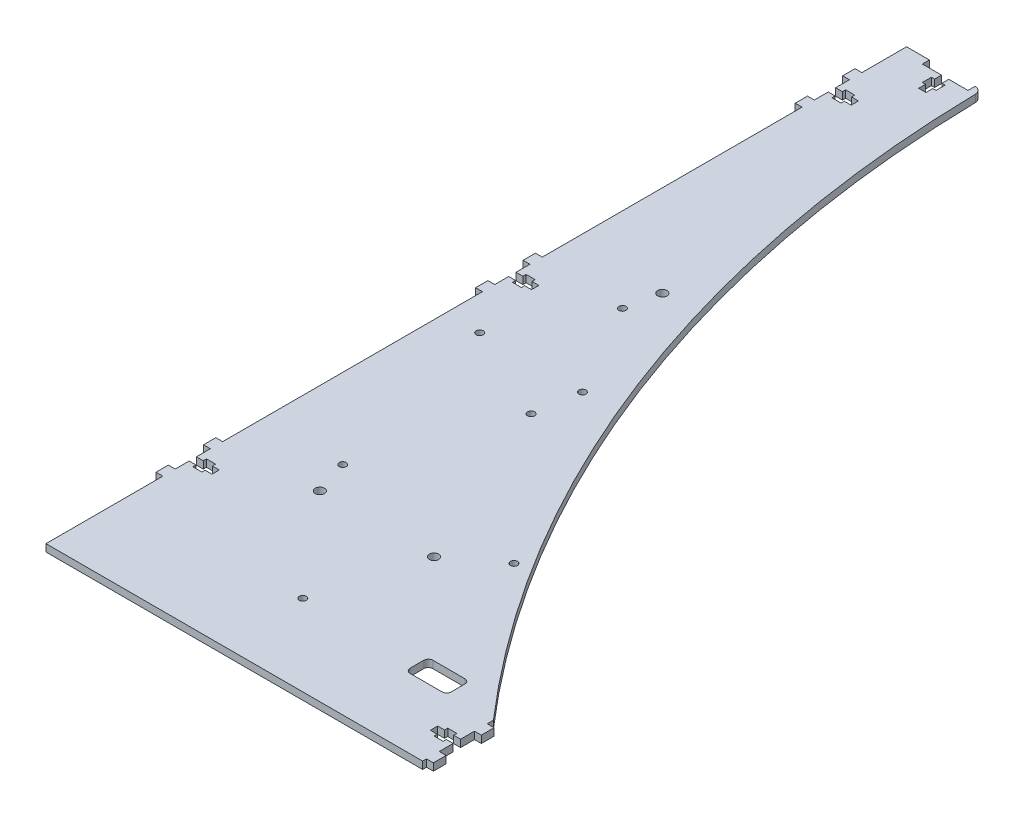
from build123d import *

# Parameters (mm, degrees)
SALIENTE_EXTRUIR1_DEPTH = 3.2
CORTAR_EXTRUIR1_DEPTH   = 3.2
REDONDEO1_R             = 3
CROQUIS3_R              = 2.05
CORTAR_EXTRUIR2_DEPTH   = 3.2
CORTAR_EXTRUIR3_DEPTH   = 3.2
CROQUIS5_R              = 1.55
CORTAR_EXTRUIR4_DEPTH   = 3.2
CROQUIS6_W              = 3
CROQUIS6_H              = 0.2
CORTAR_EXTRUIR5_DEPTH   = 3.2


with BuildPart() as part:
    # Croquis1 → Saliente-Extruir1 (new body)
    with BuildSketch(Plane(origin=(0, 0, 0), x_dir=(1, 0, 0), z_dir=(0, 1, 0))):
        Polygon((7, 65.9), (10, 65.9), (10, 62.7), (7, 62.7), (7, 61.3), (3, 61.3), (3, 62.7), (0, 62.7), (0, 56.8), (-3, 56.8), (-3, 51), (0, 51), (0, 0), (165, 0), (165, 1.5), (168, 1.5), (168, 7.5), (165, 7.5), (165, 13.4), (162, 13.4), (162, 12), (158, 12), (158, 13.4), (155, 13.4), (155, 16.6), (158, 16.6), (158, 18), (162, 18), (162, 16.6), (165, 16.6), (165, 22.5), (168, 22.5), (168, 28.5), (165, 28.5), (165, 377), (30, 377), (30, 373.9), (21.6, 373.9), (21.6, 370.9), (23, 370.9), (23, 366.9), (21.6, 366.9), (21.6, 363.9), (18.4, 363.9), (18.4, 366.9), (17, 366.9), (17, 370.9), (18.4, 370.9), (18.4, 373.9), (10, 373.9), (10, 377), (0, 377), (0, 357.6), (-3, 357.6), (-3, 351.8), (0, 351.8), (0, 345.9), (3, 345.9), (3, 347.3), (7, 347.3), (7, 345.9), (10, 345.9), (10, 342.7), (7, 342.7), (7, 341.3), (3, 341.3), (3, 342.7), (0, 342.7), (0, 336.8), (-3, 336.8), (-3, 331), (0, 331), (0, 217.6), (-3, 217.6), (-3, 211.8), (0, 211.8), (0, 205.9), (3, 205.9), (3, 207.3), (7, 207.3), (7, 205.9), (10, 205.9), (10, 202.7), (7, 202.7), (7, 201.3), (3, 201.3), (3, 202.7), (0, 202.7), (0, 196.8), (-3, 196.8), (-3, 191), (0, 191), (0, 77.6), (-3, 77.6), (-3, 71.8), (0, 71.8), (0, 65.9), (3, 65.9), (3, 67.3), (7, 67.3), align=None)
    extrude(amount=SALIENTE_EXTRUIR1_DEPTH)

    # Croquis2 → Cortar-Extruir1 (cut)
    with BuildSketch(Plane.XZ):
        with BuildLine():
            Line((165, -377), (33, -377))
            ThreePointArc((33, -377), (68.343071274, -192.304293087), (165, -31))
            Line((165, -31), (165, -377))
        make_face()
    extrude(amount=-CORTAR_EXTRUIR1_DEPTH, mode=Mode.SUBTRACT)

    # Redondeo1
    redondeo1_edges = [part.edges().sort_by_distance(p)[0] for p in [
        (33, 1.6, -377),
    ]]
    fillet(redondeo1_edges, radius=REDONDEO1_R)

    # Croquis3 → Cortar-Extruir2 (cut)
    with BuildSketch(Plane(origin=(0, 3.2, 0), x_dir=(1, 0, 0), z_dir=(0, 1, 0))):
        with Locations(Location((40, 80, 0), (0, 0, 270))):
            Circle(CROQUIS3_R)
        with Locations(Location((90, 80, 0), (0, 0, 270))):
            Circle(CROQUIS3_R)
        with Locations(Location((40, 230, 0), (0, 0, 270))):
            Circle(CROQUIS3_R)
    extrude(amount=-CORTAR_EXTRUIR2_DEPTH, mode=Mode.SUBTRACT)

    # Croquis4 → Cortar-Extruir3 (cut)
    with BuildSketch(Plane.XZ):
        with BuildLine():
            Line((143, -30.5), (129, -30.5))
            ThreePointArc((129, -30.5), (127.585786438, -31.085786438), (127, -32.5))
            Line((127, -32.5), (127, -38.5))
            ThreePointArc((127, -38.5), (127.585786438, -39.914213562), (129, -40.5))
            Line((129, -40.5), (143, -40.5))
            ThreePointArc((143, -40.5), (144.414213562, -39.914213562), (145, -38.5))
            Line((145, -38.5), (145, -32.5))
            ThreePointArc((145, -32.5), (144.414213562, -31.085786438), (143, -30.5))
        make_face()
    extrude(amount=-CORTAR_EXTRUIR3_DEPTH, mode=Mode.SUBTRACT)

    # Croquis5 → Cortar-Extruir4 (cut)
    with BuildSketch(Plane.XZ):
        with Locations(Location((110, -95, 0), (0, 0, 270))):
            Circle(CROQUIS5_R)
        with Locations(Location((35, -95, 0), (0, 0, 270))):
            Circle(CROQUIS5_R)
        with Locations(Location((15, -175, 0), (0, 0, 270))):
            Circle(CROQUIS5_R)
        with Locations(Location((60, -175, 0), (0, 0, 270))):
            Circle(CROQUIS5_R)
        with Locations(Location((77, -35.5, 0), (0, 0, 270))):
            Circle(CROQUIS5_R)
        with Locations(Location((37, -215.5, 0), (0, 0, 270))):
            Circle(CROQUIS5_R)
        with Locations(Location((57, -155.5, 0), (0, 0, 270))):
            Circle(CROQUIS5_R)
    extrude(amount=-CORTAR_EXTRUIR4_DEPTH, mode=Mode.SUBTRACT)

    # Croquis6 → Cortar-Extruir5 (cut)
    with BuildSketch(Plane.XZ):
        with Locations((-1.5, -357.5)):
            Rectangle(CROQUIS6_W, CROQUIS6_H)
        with Locations((-1.5, -351.9)):
            Rectangle(CROQUIS6_W, CROQUIS6_H)
        with Locations((-1.5, -336.7)):
            Rectangle(CROQUIS6_W, CROQUIS6_H)
        with Locations((-1.5, -331.1)):
            Rectangle(CROQUIS6_W, CROQUIS6_H)
        with Locations((-1.5, -217.5)):
            Rectangle(CROQUIS6_W, CROQUIS6_H)
        with Locations((-1.5, -211.9)):
            Rectangle(CROQUIS6_W, CROQUIS6_H)
        with Locations((-1.5, -196.7)):
            Rectangle(CROQUIS6_W, CROQUIS6_H)
        with Locations((-1.5, -191.1)):
            Rectangle(CROQUIS6_W, CROQUIS6_H)
        with Locations((-1.5, -77.5)):
            Rectangle(CROQUIS6_W, CROQUIS6_H)
        with Locations((-1.5, -71.9)):
            Rectangle(CROQUIS6_W, CROQUIS6_H)
        with Locations((-1.5, -56.7)):
            Rectangle(CROQUIS6_W, CROQUIS6_H)
        with Locations((-1.5, -51.1)):
            Rectangle(CROQUIS6_W, CROQUIS6_H)
        with Locations((166.5, -28.4)):
            Rectangle(CROQUIS6_W, CROQUIS6_H)
        with Locations((166.5, -22.6)):
            Rectangle(CROQUIS6_W, CROQUIS6_H)
        with Locations((166.5, -7.4)):
            Rectangle(CROQUIS6_W, CROQUIS6_H)
        with Locations((166.5, -1.6)):
            Rectangle(CROQUIS6_W, CROQUIS6_H)
    extrude(amount=-CORTAR_EXTRUIR5_DEPTH, mode=Mode.SUBTRACT)


solid = part.part
